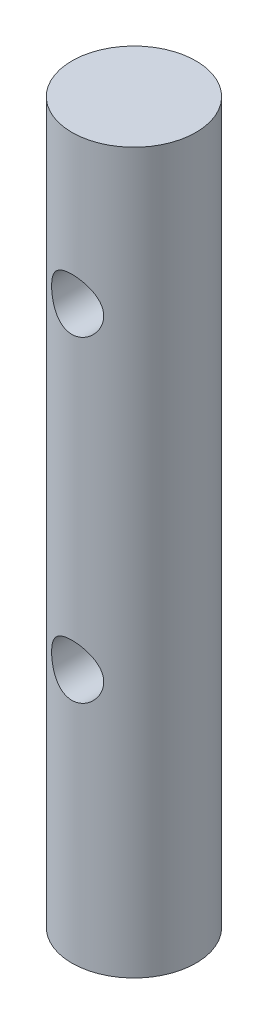
from build123d import *

# Parameters (mm, degrees)
SKETCH1_R               = 5
BOSS_EXTRUDE1_DEPTH     = 58
CUT_EXTRUDE1_DEPTH      = 59.429444632
CUT_EXTRUDE1_DEPTH_BACK = 59.429444632
SKETCH2_R               = 2.1


with BuildPart() as part:
    # Sketch1 → Boss-Extrude1 (new body)
    with BuildSketch(Plane(origin=(0, 0, 0), x_dir=(1, 0, 0), z_dir=(0, 1, 0))):
        with Locations(Location((0, 0, 0), (0, 0, 90))):
            Circle(SKETCH1_R)
    extrude(amount=BOSS_EXTRUDE1_DEPTH)

    # Sketch2 → Cut-Extrude1 (cut, two sides: drawn at the far end of the back side and taken through both)
    with BuildSketch(Plane.XY.offset(-CUT_EXTRUDE1_DEPTH_BACK)):
        with Locations(Location((0, 46, 0), (0, 0, 90))):
            Circle(SKETCH2_R)
        with Locations(Location((0, 20.45, 0), (0, 0, 90))):
            Circle(SKETCH2_R)
    extrude(amount=CUT_EXTRUDE1_DEPTH + CUT_EXTRUDE1_DEPTH_BACK, mode=Mode.SUBTRACT)


solid = part.part
